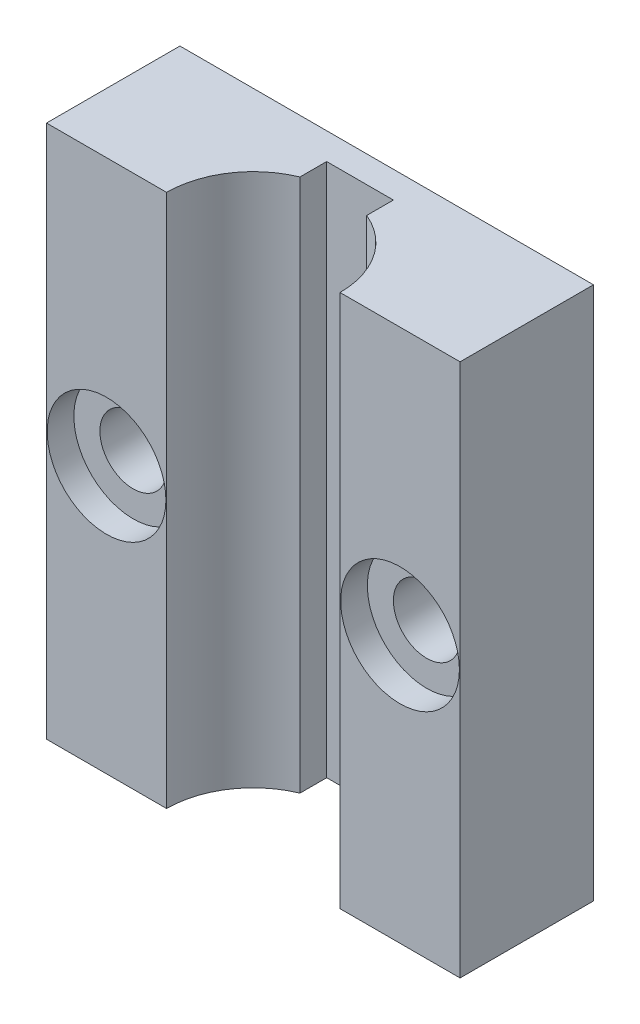
from build123d import *

# Parameters (mm, degrees)
SKETCH1_W           = 31
SKETCH1_H           = 40
BOSS_EXTRUDE1_DEPTH = 10
SKETCH2_R           = 6.5
CUT_EXTRUDE1_DEPTH  = 49.040022953
SKETCH3_R           = 2.5
CUT_EXTRUDE2_DEPTH  = 36.549524257
SKETCH3_4_R         = 4.45
SKETCH3_4_R_2       = 2.5
CUT_EXTRUDE5_DEPTH  = 2
SKETCH4_W           = 5
SKETCH4_H           = 3
CUT_EXTRUDE6_DEPTH  = 49.040022953


with BuildPart() as part:
    # Sketch1 → Boss-Extrude1 (new body)
    with BuildSketch(Plane.XY):
        with Locations((-9.154488543, 3.578059072)):
            Rectangle(SKETCH1_W, SKETCH1_H)
    extrude(amount=BOSS_EXTRUDE1_DEPTH)

    # Sketch2 → Cut-Extrude1 (cut, through all)
    with BuildSketch(Plane(origin=(0, 23.578059072, 0), x_dir=(1, 0, 0), z_dir=(0, 1, 0))):
        with Locations((-9.154488543, -10)):
            Circle(SKETCH2_R)
    extrude(amount=-CUT_EXTRUDE1_DEPTH, mode=Mode.SUBTRACT)

    # Sketch3 → Cut-Extrude2 (cut, through all)
    with BuildSketch(Plane.XY.offset(10)):
        with Locations((-20.154488543, 3.578059072)):
            Circle(SKETCH3_R)
        with Locations((1.845511457, 3.578059072)):
            Circle(SKETCH3_R)
    extrude(amount=-CUT_EXTRUDE2_DEPTH, mode=Mode.SUBTRACT)

    # Sketch3<4> → Cut-Extrude5 (cut)
    # profile 1 of 2: a face of its own
    with BuildSketch(Plane.XY.offset(10)):
        with Locations((-20.154488543, 3.578059072)):
            Circle(SKETCH3_4_R)
        with Locations((-20.154488543, 3.578059072)):
            Circle(SKETCH3_4_R_2, mode=Mode.SUBTRACT)
    # profile 2 of 2: a face of its own
    with BuildSketch(Plane.XY.offset(10)):
        with Locations((1.845511457, 3.578059072)):
            Circle(SKETCH3_4_R)
        with Locations((1.845511457, 3.578059072)):
            Circle(SKETCH3_4_R_2, mode=Mode.SUBTRACT)
    extrude(amount=-CUT_EXTRUDE5_DEPTH, mode=Mode.SUBTRACT)

    # Sketch4 → Cut-Extrude6 (cut, through all)
    with BuildSketch(Plane(origin=(0, 23.578059072, 0), x_dir=(1, 0, 0), z_dir=(0, 1, 0))):
        with Locations((-9.154488543, -3.5)):
            Rectangle(SKETCH4_W, SKETCH4_H)
    extrude(amount=-CUT_EXTRUDE6_DEPTH, mode=Mode.SUBTRACT)


solid = part.part
